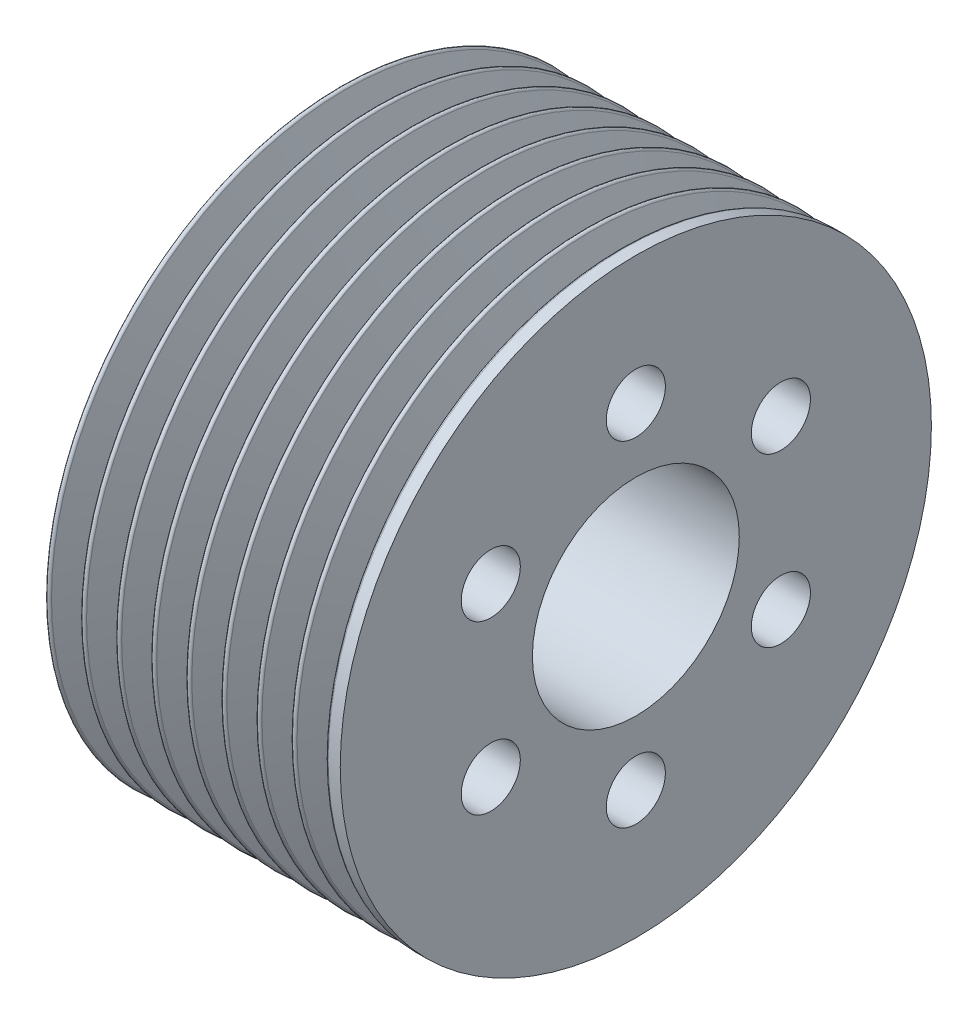
from build123d import *

# Parameters (mm, degrees)
LPATTERN1_COUNT    = 9
LPATTERN1_PITCH    = 3.56
SKETCH3_R          = 3
CUT_EXTRUDE1_DEPTH = 17.5


with BuildPart() as part:
    # Sketch1 → Revolve1 (revolve)
    with BuildSketch(Plane.XY, mode=Mode.PRIVATE) as revolve1_sk:
        Polygon((49, 10.5), (49, 30), (18, 30), (18, 21.5), (31.5, 21.5), (31.5, 10.5), align=None)
    revolve(revolve1_sk.sketch.rotate(Axis((0, 0, 0), (1, 0, 0)), 90), axis=Axis((0, 0, 0), (1, 0, 0)))

    # Sketch2 → Cut-Revolve1 (revolve, cut)
    with BuildSketch(Plane.XY, mode=Mode.PRIVATE) as cut_revolve1_sk:
        with BuildLine():
            Line((47.545831953, 29.837551845), (46.281001657, 26.45460955))
            ThreePointArc((46.281001657, 26.45460955), (46, 26.259671764), (45.718998343, 26.45460955))
            Line((45.718998343, 26.45460955), (44.454168047, 29.837551845))
            ThreePointArc((44.454168047, 29.837551845), (44.362499191, 29.955411734), (44.22, 30))
            Line((44.22, 30), (47.78, 30))
            ThreePointArc((47.78, 30), (47.637500809, 29.955411734), (47.545831953, 29.837551845))
        make_face()
    cut_revolve1 = revolve(cut_revolve1_sk.sketch.rotate(Axis((0, 0, 0), (1, 0, 0)), 90), axis=Axis((0, 0, 0), (1, 0, 0)), mode=Mode.SUBTRACT)

    # LPattern1: Cut-Revolve1 ×9
    with Locations(*[(-i * LPATTERN1_PITCH, 0, 0) for i in range(1, LPATTERN1_COUNT)]):
        add(cut_revolve1, mode=Mode.SUBTRACT)

    # Sketch3 → Cut-Extrude1 (cut)
    with BuildSketch(Plane(origin=(49, 0, 0), x_dir=(0, 0, -1), z_dir=(1, 0, 0))):
        with Locations((0, 17)):
            Circle(SKETCH3_R)
        with Locations((14.722431864, 8.5)):
            Circle(SKETCH3_R)
        with Locations((14.722431864, -8.5)):
            Circle(SKETCH3_R)
        with Locations((0, -17)):
            Circle(SKETCH3_R)
        with Locations((-14.722431864, -8.5)):
            Circle(SKETCH3_R)
        with Locations((-14.722431864, 8.5)):
            Circle(SKETCH3_R)
    extrude(amount=-CUT_EXTRUDE1_DEPTH, mode=Mode.SUBTRACT)


solid = part.part
